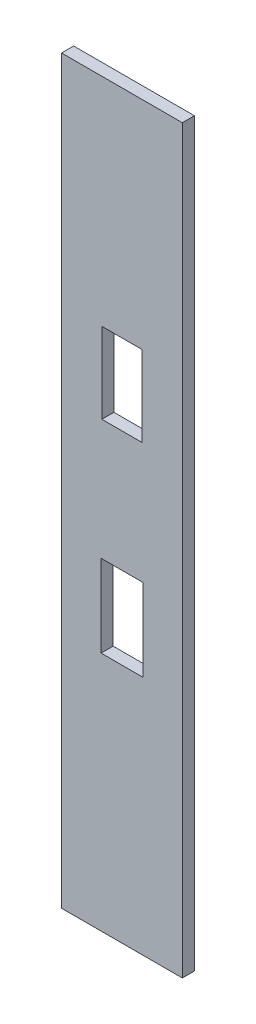
from build123d import *

# Parameters (mm, degrees)
CROQUIS1_W              = 150
CROQUIS1_H              = 920
SALIENTE_EXTRUIR1_DEPTH = 15
CROQUIS3_W              = 52
CROQUIS3_H              = 102
CORTAR_EXTRUIR1_DEPTH   = 200
CROQUIS7_W              = 50
CROQUIS7_H              = 100
CORTAR_EXTRUIR2_DEPTH   = 467.315343947


with BuildPart() as part:
    # Croquis1 → Saliente-Extruir1 (new body)
    with BuildSketch(Plane.XY):
        Rectangle(CROQUIS1_W, CROQUIS1_H)
    extrude(amount=SALIENTE_EXTRUIR1_DEPTH)

    # Croquis3 → Cortar-Extruir1 (cut, symmetric)
    with BuildSketch(Plane(origin=(0, 0, 0), x_dir=(-1, 0, 0), z_dir=(0, 0, -1))):
        with Locations((0, -110)):
            Rectangle(CROQUIS3_W, CROQUIS3_H)
    extrude(amount=CORTAR_EXTRUIR1_DEPTH, both=True, mode=Mode.SUBTRACT)

    # Croquis7 → Cortar-Extruir2 (cut, through all)
    with BuildSketch(Plane(origin=(0, 0, 0), x_dir=(-1, 0, 0), z_dir=(0, 0, -1))):
        with Locations((0, 141)):
            Rectangle(CROQUIS7_W, CROQUIS7_H)
    extrude(amount=-CORTAR_EXTRUIR2_DEPTH, mode=Mode.SUBTRACT)


solid = part.part
